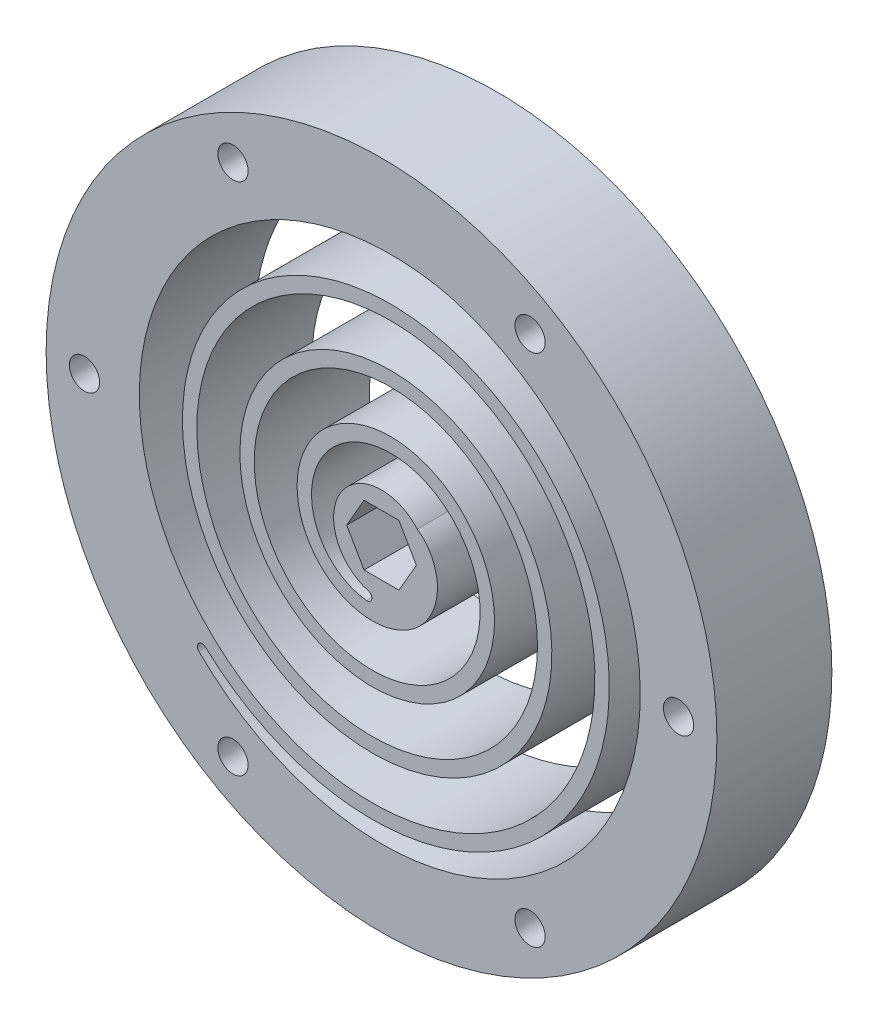
from build123d import *

# Parameters (mm, degrees)
SKETCH2_R             = 35
SKETCH2_R_2           = 1.58
SKETCH2_R_3           = 27
BOSS_EXTRUDE1_DEPTH   = 12
SKETCH2_R_4           = 5
BOSS_EXTRUDE1_2_DEPTH = 12
BOSS_EXTRUDE2_DEPTH   = 12
FILLET1_R             = 0.5


with BuildPart() as part:
    # Sketch2 → Boss-Extrude1 (new body)
    with BuildSketch(Plane.XY):
        Circle(SKETCH2_R)
        with Locations((-15.5, -26.846787517)):
            Circle(SKETCH2_R_2, mode=Mode.SUBTRACT)
        with Locations((15.5, -26.846787517)):
            Circle(SKETCH2_R_2, mode=Mode.SUBTRACT)
        with Locations((31, 0)):
            Circle(SKETCH2_R_2, mode=Mode.SUBTRACT)
        with Locations((15.5, 26.846787517)):
            Circle(SKETCH2_R_2, mode=Mode.SUBTRACT)
        with Locations((-15.5, 26.846787517)):
            Circle(SKETCH2_R_2, mode=Mode.SUBTRACT)
        with Locations((-31, 0)):
            Circle(SKETCH2_R_2, mode=Mode.SUBTRACT)
        Circle(SKETCH2_R_3, mode=Mode.SUBTRACT)
    extrude(amount=BOSS_EXTRUDE1_DEPTH)



with BuildPart() as body_2:
    # Sketch2 → Boss-Extrude1 2 (new body)
    with BuildSketch(Plane.XY):
        Circle(SKETCH2_R_4)
        Polygon((1.818653348, -3.15), (3.637306696, 0), (1.818653348, 3.15), (-1.818653348, 3.15), (-3.637306696, 0), (-1.818653348, -3.15), align=None, mode=Mode.SUBTRACT)
    extrude(amount=BOSS_EXTRUDE1_2_DEPTH)


with BuildPart() as part_1:
    add(part.part)

    add(body_2.part)  # Boss-Extrude2 merges body 2
    # Sketch6 → Boss-Extrude2 (add)
    with BuildSketch(Plane.XY):
        with BuildLine():
            ThreePointArc((3.491451229, -3.579073667), (4.996698344, -0.181674588), (3.742151166, 3.316067649))
            add(Edge.make_bspline(
                [(3.742151166, 3.316067649), (5.405637173, 2.172626038), (6.176382447, -0.048460614), (5.522426292, -3.016433528), (5.179240609, -3.798342767), (4.172585189, -5.205945429), (3.51421573, -5.823822155), (1.954309545, -6.774553608), (1.060464068, -7.102255329), (-0.842435997, -7.381814669), (-1.842456056, -7.331944253), (-3.79734951, -6.823014028), (-4.743274985, -6.365874682), (-6.422843032, -5.077259248), (-7.149019447, -4.251013218), (-8.243889376, -2.32669514), (-8.607749388, -1.236319945), (-8.881677249, 1.058532736), (-8.790279524, 2.254060365), (-8.126630222, 4.56922097), (-7.556492736, 5.680048452), (-5.987347235, 7.633648104), (-4.993692604, 8.469126236), (-2.705425607, 9.710222468), (-1.418568293, 10.111186556), (1.268545938, 10.381292353), (2.659851114, 10.249138743), (5.336117672, 9.432118356), (6.612317672, 8.749515), (8.841069116, 6.900650074), (9.786406035, 5.739862407), (11.174906114, 3.087932755), (11.613519794, 1.604632423), (11.880859739, -1.474902665), (11.708410082, -3.062136007), (10.738831321, -6.099993578), (9.944089787, -7.541844852), (7.816011443, -10.046421924), (6.488267269, -11.10195893), (3.472865273, -12.638592038), (1.793152392, -13.115198602), (-1.67889376, -13.380443389), (-3.462147119, -13.167994097), (-6.861900332, -12.046385481), (-8.469581316, -11.1397221), (-11.250420452, -8.732768064), (-12.416381694, -7.238187431), (-14.101630682, -3.85944624), (-14.616460208, -1.983344394), (-14.880062543, 1.881267682), (-14.62781595, 3.860600904), (-13.354540796, 7.62245317), (-12.336105971, 9.396084857), (-9.650513122, 12.453484763), (-7.989181433, 13.730025331), (-4.247197892, 15.564226478), (-2.17472547, 16.117440718), (2.082487805, 16.379720667), (4.258867324, 16.087501403), (7.350549511, 15.019470112), (8.351294569, 14.559779759), (10.254268996, 13.445644097), (11.155612652, 12.791703035), (12.821968995, 11.310323106), (13.586211688, 10.483552232), (14.945124964, 8.685105656), (15.539171095, 7.714235893), (16.530444806, 5.662538393), (16.927217674, 4.582623408), (17.503903346, 2.352879919), (17.683548823, 1.20403571), (17.814090265, -1.119909829), (17.764916689, -2.293993362), (17.434723485, -4.622809212), (17.153834863, -5.776529574), (16.366210789, -8.018830028), (15.859801904, -9.106443137), (14.636178457, -11.172372991), (13.919473481, -12.149805127), (12.298925706, -13.954634255), (11.395755892, -14.781263244), (9.43380606, -16.248847712), (8.375836489, -16.889181533), (6.142579889, -17.955150369), (4.96820951, -18.380334167), (2.545824388, -18.994869315), (1.298797128, -19.183957409), (-1.221473342, -19.314048275), (-2.493696357, -19.25498602), (-5.014979486, -18.886058902), (-6.263026094, -18.576329858), (-8.686543173, -17.713175789), (-9.86104599, -17.16008229), (-12.089980767, -15.827033501), (-13.143528329, -15.047592748), (-15.086889002, -13.287927121), (-15.97593518, -12.308380025), (-17.552256079, -10.18296338), (-18.238911025, -9.037908767), (-19.379643855, -6.623115418), (-19.833273147, -5.354297385), (-20.485727459, -2.739278909), (-20.684292498, -1.394069444), (-20.814000625, 1.322531217), (-20.745082502, 2.69289938), (-20.337485017, 5.406667579), (-19.998945705, 6.74905201), (-19.06031876, 9.353814632), (-18.460567164, 10.615223864), (-17.018141952, 13.007201869), (-16.175987515, 14.136885768), (-14.27724339, 16.218823693), (-13.221336107, 17.170311146), (-10.932481504, 18.855419441), (-9.700353585, 19.588421686), (-7.104041355, 20.803972519), (-5.740781907, 21.286074464), (-2.933136901, 21.976502788), (-1.489746046, 22.18457184), (1.423188664, 22.313950805), (2.891706315, 22.235202776), (5.797973393, 21.788985283), (7.234704696, 21.421659642), (10.020735555, 20.407605244), (11.369064362, 19.761216676), (13.924115839, 18.209454083), (15.129952629, 17.304603631), (17.350504056, 15.266812543), (18.364451928, 14.134558802), (20.158388193, 11.682289482), (20.937758612, 10.363097739), (22.228170585, 7.585281135), (22.738766915, 6.127585374), (23.467213195, 3.127319522), (23.684807981, 1.585748034), (23.813900838, -1.523523621), (23.725343799, -3.090194152), (23.240546886, -6.188971036), (22.84445424, -7.720056414), (21.755009107, -10.687373646), (21.06200067, -12.122632575), (19.400932356, -14.840781822), (18.43340024, -16.122784831), (16.256587851, -18.481978996), (15.047998846, -19.558402754), (12.432333802, -21.461199813), (11.026086009, -22.286955324), (8.06677697, -23.65226344), (6.51464912, -24.191371812), (3.321767201, -24.957871802), (1.682015769, -25.185010019), (-1.623595047, -25.313851889), (-3.288421159, -25.215502907), (-6.579716638, -24.692159767), (-8.205161916, -24.26731594), (-11.35378024, -23.102510177), (-12.875977877, -22.362895916), (-15.757244706, -20.592547909), (-17.115424823, -19.562345945), (-19.613285645, -17.246533418), (-20.752197964, -15.961618398), (-22.763882752, -13.182573353), (-23.636037254, -11.689275958), (-25.076270306, -8.548484426), (-25.643905264, -6.901928025), (-26.448488443, -3.51643409), (-26.685184702, -1.778503338), (-26.813804607, 1.723448363), (-26.705677805, 3.486432238), (-26.330271639, 5.814135958), (-26.21627075, 6.397429618), (-26.082978562, 6.976978523)],
                knots=[-0.026854194, -0.026854194, -0.026854194, -0.026854194, 0.015625, 0.015625, 0.03125, 0.03125, 0.046875, 0.046875, 0.0625, 0.0625, 0.078125, 0.078125, 0.09375, 0.09375, 0.109375, 0.109375, 0.125, 0.125, 0.140625, 0.140625, 0.15625, 0.15625, 0.171875, 0.171875, 0.1875, 0.1875, 0.203125, 0.203125, 0.21875, 0.21875, 0.234375, 0.234375, 0.25, 0.25, 0.265625, 0.265625, 0.28125, 0.28125, 0.296875, 0.296875, 0.3125, 0.3125, 0.328125, 0.328125, 0.34375, 0.34375, 0.359375, 0.359375, 0.375, 0.375, 0.390625, 0.390625, 0.40625, 0.40625, 0.421875, 0.421875, 0.4375, 0.4375, 0.453125, 0.453125, 0.4609375, 0.4609375, 0.46875, 0.46875, 0.4765625, 0.4765625, 0.484375, 0.484375, 0.4921875, 0.4921875, 0.5, 0.5, 0.5078125, 0.5078125, 0.515625, 0.515625, 0.5234375, 0.5234375, 0.53125, 0.53125, 0.5390625, 0.5390625, 0.546875, 0.546875, 0.5546875, 0.5546875, 0.5625, 0.5625, 0.5703125, 0.5703125, 0.578125, 0.578125, 0.5859375, 0.5859375, 0.59375, 0.59375, 0.6015625, 0.6015625, 0.609375, 0.609375, 0.6171875, 0.6171875, 0.625, 0.625, 0.6328125, 0.6328125, 0.640625, 0.640625, 0.6484375, 0.6484375, 0.65625, 0.65625, 0.6640625, 0.6640625, 0.671875, 0.671875, 0.6796875, 0.6796875, 0.6875, 0.6875, 0.6953125, 0.6953125, 0.703125, 0.703125, 0.7109375, 0.7109375, 0.71875, 0.71875, 0.7265625, 0.7265625, 0.734375, 0.734375, 0.7421875, 0.7421875, 0.75, 0.75, 0.7578125, 0.7578125, 0.765625, 0.765625, 0.7734375, 0.7734375, 0.78125, 0.78125, 0.7890625, 0.7890625, 0.796875, 0.796875, 0.8046875, 0.8046875, 0.8125, 0.8125, 0.8203125, 0.8203125, 0.828125, 0.828125, 0.8359375, 0.8359375, 0.84375, 0.84375, 0.8515625, 0.8515625, 0.859375, 0.859375, 0.8671875, 0.8671875, 0.875, 0.875, 0.8828125, 0.8828125, 0.885439792, 0.885439792, 0.885439792, 0.885439792], degree=3))
            ThreePointArc((-26.082978562, 6.976978523), (-13.498280103, 23.383678801), (7.003084633, 26.075981393))
            add(Edge.make_bspline(
                [(3.491451229, -3.579073667), (3.479692282, -3.595969173), (3.467813495, -3.612806552), (3.071478786, -4.166999954), (2.559445922, -4.64909122), (1.347772897, -5.387581564), (0.641231953, -5.647744671), (-0.859260023, -5.868185331), (-1.660906496, -5.829210168), (-3.223082328, -5.422518695), (-3.990875759, -5.052517838), (-5.349102878, -4.010444887), (-5.945253092, -3.333505375), (-6.840163827, -1.760630954), (-7.142250612, -0.858075157), (-7.368322751, 1.035862366), (-7.292792927, 2.03454584), (-6.740261666, 3.962067809), (-6.26090031, 4.897742452), (-4.943997059, 6.537298333), (-4.10168293, 7.246505469), (-2.16714414, 8.295748764), (-1.068525891, 8.638813444), (1.218548246, 8.868707647), (2.413998744, 8.755851738), (4.706028048, 8.056132697), (5.809113392, 7.466878573), (7.728877848, 5.874334381), (8.550584834, 4.866370068), (9.752983149, 2.569880646), (10.136480206, 1.275160843), (10.369140261, -1.404890601), (10.218498429, -2.796957504), (9.370778897, -5.453009084), (8.671304314, -6.723226372), (6.802613171, -8.922525568), (5.628822147, -9.856391105), (2.970191781, -11.211215254), (1.479339955, -11.634801398), (-1.593598587, -11.869556611), (-3.182190045, -11.680832444), (-6.201959271, -10.684583902), (-7.639130068, -9.874672528), (-10.117527567, -7.729496711), (-11.163327506, -6.389758926), (-12.670094641, -3.368854467), (-13.133539792, -1.681847036), (-13.369937457, 1.783923747), (-13.142928621, 3.568979914), (-11.997787752, 6.952263374), (-11.077289185, 8.556266687), (-8.655391812, 11.313463783), (-7.149621866, 12.471043033), (-3.766346468, 14.129416874), (-1.88316504, 14.632559282), (1.975402706, 14.870279333), (3.955957146, 14.605161199), (6.76733672, 13.633961323), (7.678724559, 13.215376658), (9.411099348, 12.201122076), (10.232868394, 11.604980001), (11.751490736, 10.254934635), (12.449017802, 9.500415897), (13.688772555, 7.859669036), (14.231539897, 6.97270629), (15.136833113, 5.098967676), (15.499743978, 4.111366668), (16.026945109, 2.072954161), (16.191451177, 1.021259086), (16.310909735, -1.105384967), (16.26590088, -2.181241694), (15.963446974, -4.314415371), (15.70586233, -5.372629125), (14.983719528, -7.428509822), (14.51884931, -8.427028013), (13.395910593, -10.322964728), (12.73736999, -11.221156171), (11.248812288, -12.878985911), (10.418181613, -13.639289122), (8.614420654, -14.988544604), (7.640559312, -15.578028341), (5.585573156, -16.558905864), (4.503628271, -16.950677431), (2.272703918, -17.516640876), (1.122847209, -17.691042591), (-1.200170996, -17.810951725), (-2.374232925, -17.756493286), (-4.700092803, -17.416161503), (-5.852779581, -17.130145648), (-8.090250296, -16.333253409), (-9.175877183, -15.822063721), (-11.235326328, -14.590378426), (-12.209913221, -13.869411159), (-14.006891599, -12.242291124), (-14.829940063, -11.335526856), (-16.288631034, -9.368715357), (-16.924797731, -8.307940654), (-17.981190692, -6.071684602), (-18.401788398, -4.895388102), (-19.006444469, -2.471943624), (-19.190707502, -1.223924434), (-19.310999375, 1.295462661), (-19.24705854, 2.567724129), (-18.868785334, 5.086252415), (-18.554308116, 6.333400639), (-17.682609319, 8.752432456), (-17.125073644, 9.925151331), (-15.784592852, 12.148074602), (-15.001176827, 13.199036033), (-13.235455106, 15.135117344), (-12.252540149, 16.020886974), (-10.122649255, 17.588962469), (-8.974949455, 18.271785951), (-6.55740564, 19.403640342), (-5.286751285, 19.853037026), (-2.670779859, 20.496330876), (-1.324597373, 20.69042816), (1.391154755, 20.811049195), (2.761611421, 20.737600002), (5.472794307, 20.321335014), (6.814394928, 19.978372492), (9.414965153, 19.031821716), (10.674762856, 18.42791893), (13.061130008, 16.978603598), (14.188449424, 16.132721147), (16.263597416, 14.228366205), (17.212069068, 13.16928683), (18.889488515, 10.8762933), (19.618947906, 9.64165892), (20.826220589, 7.042812835), (21.304394522, 5.677795524), (21.986282206, 2.869291464), (22.190192019, 1.424944926), (22.311099162, -1.487169339), (22.228120716, -2.95581781), (21.773823357, -5.859644369), (21.402356208, -7.295690186), (20.380916735, -10.077780681), (19.730629732, -11.424646665), (18.172448201, -13.9744334), (17.264084973, -15.178097474), (15.221071149, -17.392282912), (14.085816161, -18.403441119), (11.629701002, -20.190171691), (10.308124269, -20.966250076), (7.527963975, -22.248906048), (6.068579483, -22.75583957), (3.067538012, -23.476285335), (1.525026731, -23.689989981), (-1.583447453, -23.811148111), (-3.15028503, -23.718623344), (-6.246746472, -23.226260422), (-7.777231658, -22.826272822), (-10.740827706, -21.729914546), (-12.174753386, -21.033229283), (-14.887939892, -19.366155524), (-16.167937734, -18.395299702), (-18.521136698, -16.213605834), (-19.594968786, -15.002165985), (-21.49098355, -12.382913474), (-22.313667027, -10.974387939), (-23.671677496, -8.012903494), (-24.207356065, -6.459148284), (-24.96633043, -3.265565349), (-25.189815298, -1.624888703), (-25.311195393, 1.679943678), (-25.209110182, 3.344968178), (-24.678654206, 6.63405733), (-24.250133031, 8.258977106), (-23.078830961, 11.404066598), (-22.335735766, 12.925044895), (-20.559748119, 15.801614805), (-19.526389858, 17.157937405), (-17.205998288, 19.650130075), (-15.91836585, 20.786625528), (-13.135962823, 22.79190211), (-11.640483075, 23.66117912), (-8.49766611, 25.094520116), (-6.849537193, 25.658931609), (-3.463409331, 26.456409982), (-1.72456676, 26.68966287), (1.776622457, 26.811240667), (3.539832092, 26.699583197), (5.857600941, 26.321085777), (6.432152558, 26.20789909), (7.003084633, 26.075981393)],
                knots=[0.030762211, 0.030762211, 0.030762211, 0.030762211, 0.03125, 0.03125, 0.046875, 0.046875, 0.0625, 0.0625, 0.078125, 0.078125, 0.09375, 0.09375, 0.109375, 0.109375, 0.125, 0.125, 0.140625, 0.140625, 0.15625, 0.15625, 0.171875, 0.171875, 0.1875, 0.1875, 0.203125, 0.203125, 0.21875, 0.21875, 0.234375, 0.234375, 0.25, 0.25, 0.265625, 0.265625, 0.28125, 0.28125, 0.296875, 0.296875, 0.3125, 0.3125, 0.328125, 0.328125, 0.34375, 0.34375, 0.359375, 0.359375, 0.375, 0.375, 0.390625, 0.390625, 0.40625, 0.40625, 0.421875, 0.421875, 0.4375, 0.4375, 0.453125, 0.453125, 0.4609375, 0.4609375, 0.46875, 0.46875, 0.4765625, 0.4765625, 0.484375, 0.484375, 0.4921875, 0.4921875, 0.5, 0.5, 0.5078125, 0.5078125, 0.515625, 0.515625, 0.5234375, 0.5234375, 0.53125, 0.53125, 0.5390625, 0.5390625, 0.546875, 0.546875, 0.5546875, 0.5546875, 0.5625, 0.5625, 0.5703125, 0.5703125, 0.578125, 0.578125, 0.5859375, 0.5859375, 0.59375, 0.59375, 0.6015625, 0.6015625, 0.609375, 0.609375, 0.6171875, 0.6171875, 0.625, 0.625, 0.6328125, 0.6328125, 0.640625, 0.640625, 0.6484375, 0.6484375, 0.65625, 0.65625, 0.6640625, 0.6640625, 0.671875, 0.671875, 0.6796875, 0.6796875, 0.6875, 0.6875, 0.6953125, 0.6953125, 0.703125, 0.703125, 0.7109375, 0.7109375, 0.71875, 0.71875, 0.7265625, 0.7265625, 0.734375, 0.734375, 0.7421875, 0.7421875, 0.75, 0.75, 0.7578125, 0.7578125, 0.765625, 0.765625, 0.7734375, 0.7734375, 0.78125, 0.78125, 0.7890625, 0.7890625, 0.796875, 0.796875, 0.8046875, 0.8046875, 0.8125, 0.8125, 0.8203125, 0.8203125, 0.828125, 0.828125, 0.8359375, 0.8359375, 0.84375, 0.84375, 0.8515625, 0.8515625, 0.859375, 0.859375, 0.8671875, 0.8671875, 0.875, 0.875, 0.8828125, 0.8828125, 0.890625, 0.890625, 0.8984375, 0.8984375, 0.90625, 0.90625, 0.9140625, 0.9140625, 0.921875, 0.921875, 0.9296875, 0.9296875, 0.9375, 0.9375, 0.9453125, 0.9453125, 0.947901535, 0.947901535, 0.947901535, 0.947901535], degree=3))
        make_face()
    extrude(amount=BOSS_EXTRUDE2_DEPTH)

    # Fillet1
    fillet1_edges = [part_1.edges().sort_by_distance(p)[0] for p in [
        (-26.082978562, 6.976978523, 6),
        (3.491451229, -3.579073667, 6),
    ]]
    fillet(fillet1_edges, radius=FILLET1_R)


solid = part_1.part
